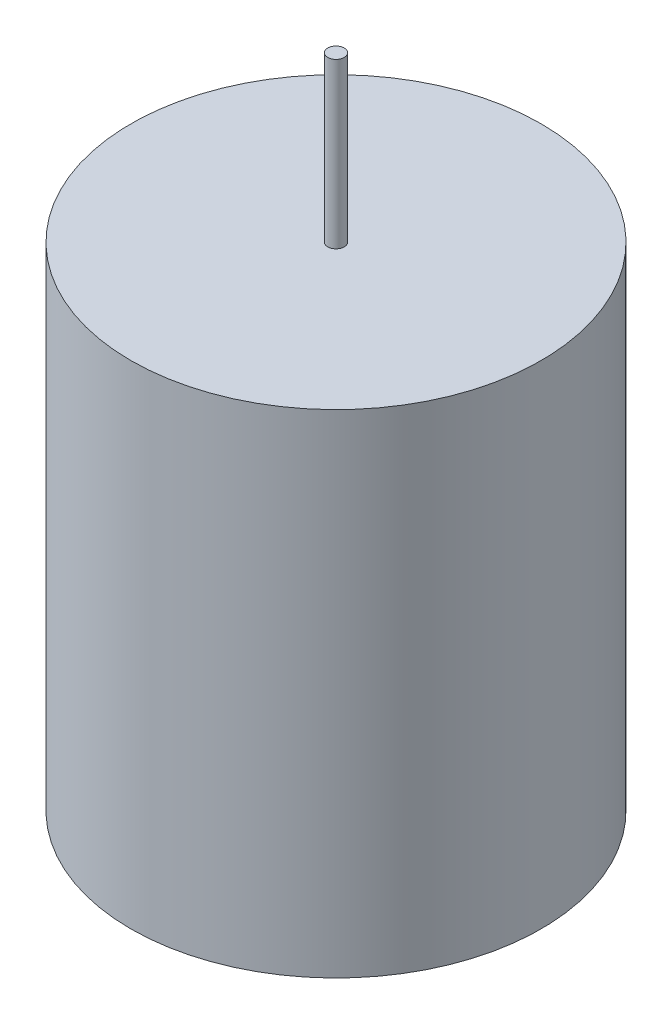
from build123d import *

# Parameters (mm, degrees)
SKETCH1_R                = 12.5
BOSS_EXTRUDE1_DEPTH      = 30
BOSS_EXTRUDE2_DEPTH      = 10
BOSS_EXTRUDE2_DEPTH_BACK = 35
SKETCH2_R                = 0.5


with BuildPart() as part:
    # Sketch1 → Boss-Extrude1 (new body)
    with BuildSketch(Plane(origin=(0, 0, 0), x_dir=(1, 0, 0), z_dir=(0, 1, 0))):
        with Locations(Location((0, 0, 0), (0, 0, 270))):
            Circle(SKETCH1_R)
    extrude(amount=BOSS_EXTRUDE1_DEPTH)

    # Sketch2 → Boss-Extrude2 (add, two sides: drawn at the far end of the back side and taken through both)
    with BuildSketch(Plane(origin=(0, 30, 0), x_dir=(1, 0, 0), z_dir=(0, 1, 0)).offset(-BOSS_EXTRUDE2_DEPTH_BACK)):
        with Locations(Location((0, 0, 0), (0, 0, 270))):
            Circle(SKETCH2_R)
    extrude(amount=BOSS_EXTRUDE2_DEPTH + BOSS_EXTRUDE2_DEPTH_BACK)


solid = part.part
